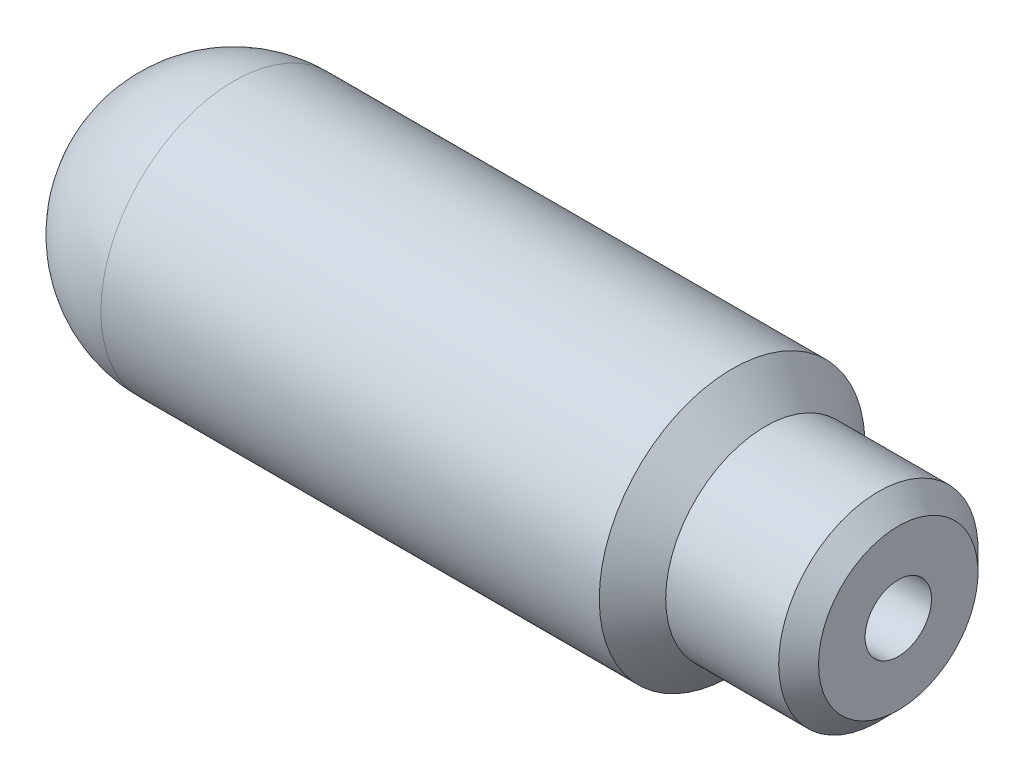
from build123d import *


with BuildPart() as part:
    # Sketch1 → Revolve1 (revolve)
    with BuildSketch(Plane.XY, mode=Mode.PRIVATE) as revolve1_sk:
        with BuildLine():
            Line((0, 0), (95, 0))
            Line((95, 0), (95, 5))
            Line((95, 5), (120, 5))
            Line((120, 5), (120, 12))
            Line((120, 12), (117, 15))
            Line((117, 15), (100, 15))
            Line((100, 15), (95, 20))
            Line((95, 20), (20, 20))
            ThreePointArc((20, 20), (5.857864376, 14.142135624), (0, 0))
        make_face()
    revolve(revolve1_sk.sketch.rotate(Axis((0, 0, 0), (1, 0, 0)), 90), axis=Axis((0, 0, 0), (1, 0, 0)))


solid = part.part
